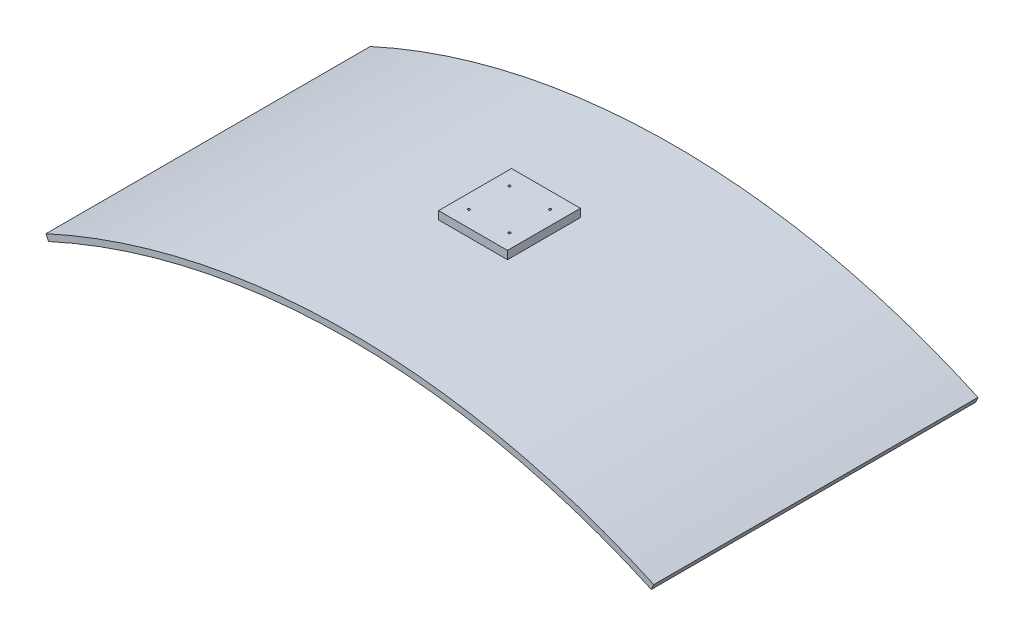
from build123d import *

# Parameters (mm, degrees)
EXTRU_MINCE1_DEPTH      = 800
ENL_V_START             = -790
ENL_V_MAT_EXTRU_1_DEPTH = 780
SKETCH2_W               = 20
SKETCH2_H               = 40
BOSS_EXTRUDE1_DEPTH     = 45
SKETCH3_W               = 170
SKETCH3_H               = 180
BOSS_EXTRUDE2_DEPTH     = 20
SKETCH4_R               = 3
CUT_EXTRUDE1_DEPTH      = 20


with BuildPart() as part:
    # Esquisse1 → Extru.-Mince1 (new body)
    with BuildSketch(Plane.XY):
        with BuildLine():
            ThreePointArc((0, 0), (750, 163.693182805), (1500, 0))
            Line((1500, 0), (1493.75, -13.635890143))
            ThreePointArc((1493.75, -13.635890143), (750, 148.693182805), (6.25, -13.635890143))
            Line((6.25, -13.635890143), (0, 0))
        make_face()
    extrude(amount=EXTRU_MINCE1_DEPTH)

    # Esquisse2 → Enlèv. mat.-Extru.1 (cut)
    with BuildSketch(Plane.XY.offset(800).offset(ENL_V_START)):
        with BuildLine():
            Line((15.352264856, -9.494687524), (14.935591654, -8.585613923))
            ThreePointArc((14.935591654, -8.585613923), (750, 149.693182805), (1485.064408346, -8.585613923))
            Line((1485.064408346, -8.585613923), (1484.647735144, -9.494687524))
            ThreePointArc((1484.647735144, -9.494687524), (750, 148.693182805), (15.352264856, -9.494687524))
        make_face()
    extrude(amount=ENL_V_MAT_EXTRU_1_DEPTH, mode=Mode.SUBTRACT)


with BuildPart() as body_2:
    # Sketch2 → Boss-Extrude1 (new, symmetric)
    with BuildSketch(Plane(origin=(743.75, 0, 0), x_dir=(0, 0, -1), z_dir=(1, 0, 0))):
        with Locations((-400, 183.693182805)):
            Rectangle(SKETCH2_W, SKETCH2_H)
    extrude(amount=BOSS_EXTRUDE1_DEPTH, both=True)

    # Sketch3 → Boss-Extrude2 (add)
    with BuildSketch(Plane(origin=(0, 203.693182805, 0), x_dir=(1, 0, 0), z_dir=(0, 1, 0))):
        with Locations((743.829806204, -400)):
            Rectangle(SKETCH3_W, SKETCH3_H)
    extrude(amount=BOSS_EXTRUDE2_DEPTH)

    # Sketch4 → Cut-Extrude1 (cut)
    with BuildSketch(Plane(origin=(0, 223.693182805, 0), x_dir=(1, 0, 0), z_dir=(0, 1, 0))):
        with Locations(Location((693.829806204, -450, 0), (0, 0, 270))):
            Circle(SKETCH4_R)
        with Locations(Location((793.829806204, -450, 0), (0, 0, 270))):
            Circle(SKETCH4_R)
        with Locations(Location((693.829806204, -350, 0), (0, 0, 270))):
            Circle(SKETCH4_R)
        with Locations(Location((793.829806204, -350, 0), (0, 0, 270))):
            Circle(SKETCH4_R)
    extrude(amount=-CUT_EXTRUDE1_DEPTH, mode=Mode.SUBTRACT)


solid = Compound([part.part, body_2.part])
